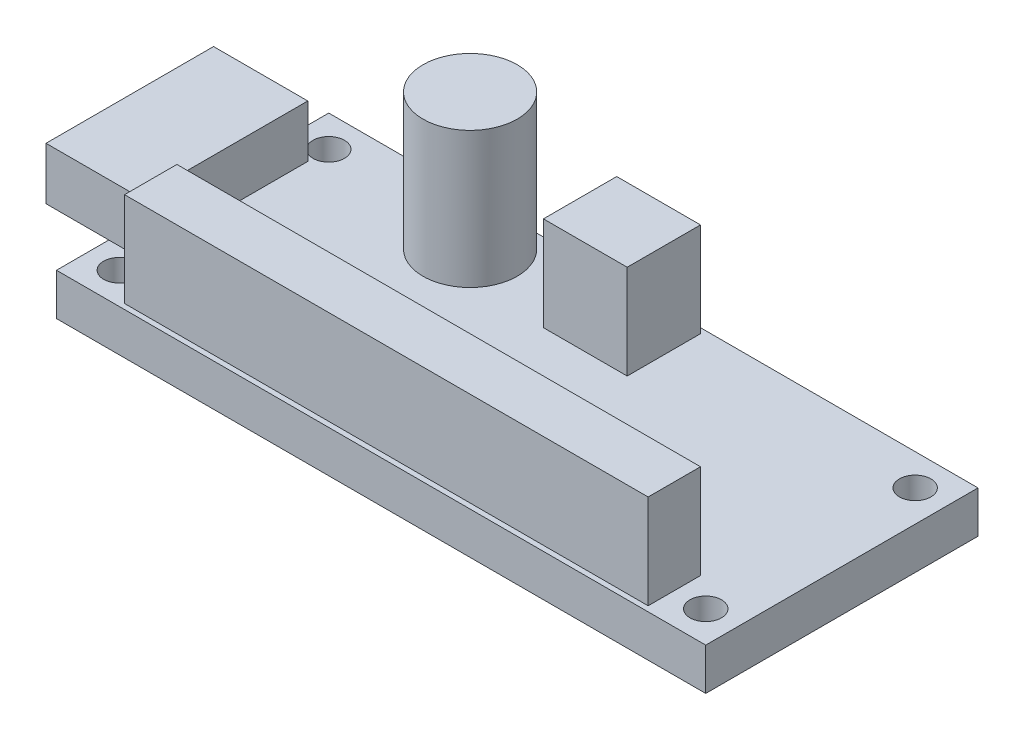
from build123d import *

# Parameters (mm, degrees)
SKETCH_1_W          = 62
SKETCH_1_H          = 26
EXTRUDE_1_DEPTH     = 4
SKETCH_2_R          = 1.5
CUT_EXTRUDE_1_DEPTH = 68.349832962
SKETCH_3_W          = 50
SKETCH_3_H          = 5
EXTRUDE_2_DEPTH     = 9
SKETCH_4_R          = 4.5
EXTRUDE_3_DEPTH     = 13
SKETCH_5_W          = 8
SKETCH_5_H          = 7
EXTRUDE_4_DEPTH     = 9
SKETCH_6_W          = 9
SKETCH_6_H          = 16
EXTRUDE_5_DEPTH     = 5


with BuildPart() as part:
    # 草图1 → 凸台-拉伸1 (new body)
    with BuildSketch(Plane(origin=(0, 0, 0), x_dir=(1, 0, 0), z_dir=(0, 1, 0))):
        with Locations((31, 13)):
            Rectangle(SKETCH_1_W, SKETCH_1_H)
    extrude(amount=EXTRUDE_1_DEPTH)

    # 草图2 → 切除-拉伸1 (cut, through all)
    with BuildSketch(Plane(origin=(0, 4, 0), x_dir=(1, 0, 0), z_dir=(0, 1, 0))):
        with Locations(Location((3, 23, 0), (0, 0, 270))):
            Circle(SKETCH_2_R)
        with Locations(Location((3, 3, 0), (0, 0, 270))):
            Circle(SKETCH_2_R)
        with Locations(Location((59, 3, 0), (0, 0, 270))):
            Circle(SKETCH_2_R)
        with Locations(Location((59, 23, 0), (0, 0, 270))):
            Circle(SKETCH_2_R)
    extrude(amount=-CUT_EXTRUDE_1_DEPTH, mode=Mode.SUBTRACT)

    # 草图3 → 凸台-拉伸2 (add)
    with BuildSketch(Plane(origin=(0, 4, 0), x_dir=(1, 0, 0), z_dir=(0, 1, 0))):
        with Locations((31, 3)):
            Rectangle(SKETCH_3_W, SKETCH_3_H)
    extrude(amount=EXTRUDE_2_DEPTH)

    # 草图4 → 凸台-拉伸3 (add)
    with BuildSketch(Plane(origin=(0, 4, 0), x_dir=(1, 0, 0), z_dir=(0, 1, 0))):
        with Locations(Location((18, 21.5, 0), (0, 0, 90))):
            Circle(SKETCH_4_R)
    extrude(amount=EXTRUDE_3_DEPTH)

    # 草图5 → 凸台-拉伸4 (add)
    with BuildSketch(Plane(origin=(0, 4, 0), x_dir=(1, 0, 0), z_dir=(0, 1, 0))):
        with Locations((32, 22)):
            Rectangle(SKETCH_5_W, SKETCH_5_H)
    extrude(amount=EXTRUDE_4_DEPTH)

    # 草图6 → 凸台-拉伸5 (add)
    with BuildSketch(Plane(origin=(0, 4, 0), x_dir=(1, 0, 0), z_dir=(0, 1, 0))):
        with Locations((-1.5, 13)):
            Rectangle(SKETCH_6_W, SKETCH_6_H)
    extrude(amount=EXTRUDE_5_DEPTH)


solid = part.part
